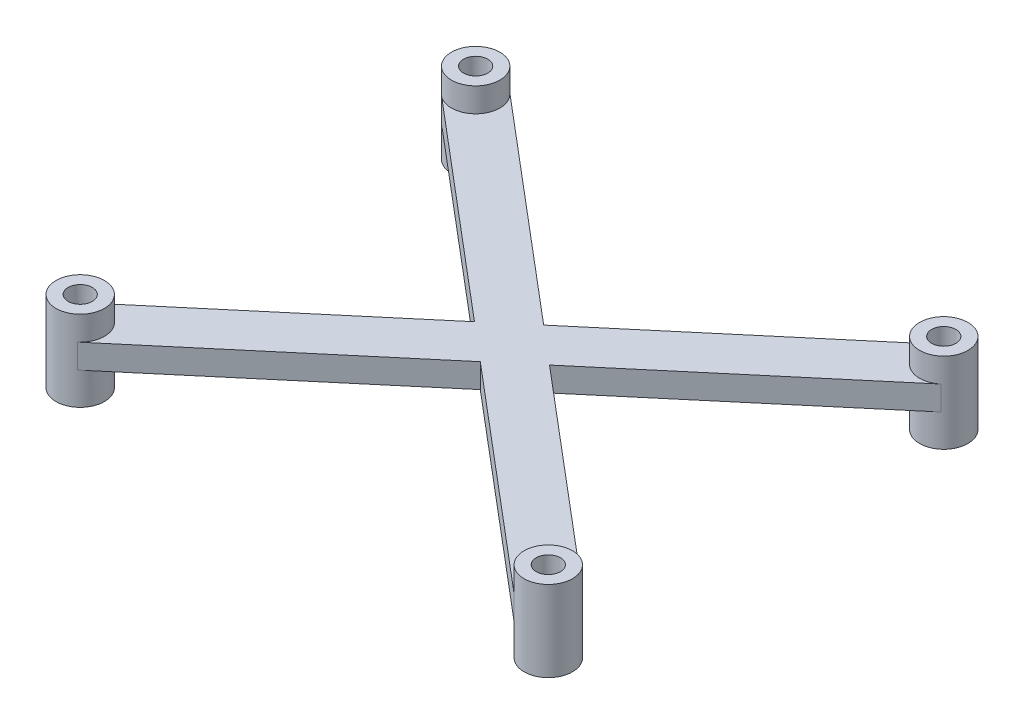
from build123d import *

# Parameters (mm, degrees)
CROQUIS1_R                = 3
SALIENTE_EXTRUIR1_DEPTH   = 4
SALIENTE_EXTRUIR1_2_DEPTH = 4
SALIENTE_EXTRUIR1_3_DEPTH = 4
SALIENTE_EXTRUIR1_4_DEPTH = 4
SALIENTE_EXTRUIR2_START   = 3
SALIENTE_EXTRUIR2_DEPTH   = 3
SALIENTE_EXTRUIR3_START   = 3
CROQUIS3_R                = 3
SALIENTE_EXTRUIR3_DEPTH   = 3
CROQUIS5_R                = 1.5
CORTAR_EXTRUIR1_DEPTH     = 13


with BuildPart() as part:
    # Croquis1 → Saliente-Extruir1 (new body)
    with BuildSketch(Plane(origin=(0, 0, 0), x_dir=(1, 0, 0), z_dir=(0, 1, 0))):
        with Locations(Location((-29, 24.5, 0), (0, 0, 270))):
            Circle(CROQUIS1_R)
    extrude(amount=-SALIENTE_EXTRUIR1_DEPTH)



with BuildPart() as body_2:
    # Croquis1 → Saliente-Extruir1 2 (new body)
    with BuildSketch(Plane(origin=(0, 0, 0), x_dir=(1, 0, 0), z_dir=(0, 1, 0))):
        with Locations(Location((-29, -24.5, 0), (0, 0, 270))):
            Circle(CROQUIS1_R)
    extrude(amount=-SALIENTE_EXTRUIR1_2_DEPTH)


with BuildPart() as body_3:
    # Croquis1 → Saliente-Extruir1 3 (new body)
    with BuildSketch(Plane(origin=(0, 0, 0), x_dir=(1, 0, 0), z_dir=(0, 1, 0))):
        with Locations(Location((29, -24.5, 0), (0, 0, 270))):
            Circle(CROQUIS1_R)
    extrude(amount=-SALIENTE_EXTRUIR1_3_DEPTH)


with BuildPart() as body_4:
    # Croquis1 → Saliente-Extruir1 4 (new body)
    with BuildSketch(Plane(origin=(0, 0, 0), x_dir=(1, 0, 0), z_dir=(0, 1, 0))):
        with Locations(Location((29, 24.5, 0), (0, 0, 270))):
            Circle(CROQUIS1_R)
    extrude(amount=-SALIENTE_EXTRUIR1_4_DEPTH)


with BuildPart() as part_1:
    add(part.part)

    add(body_2.part)  # Saliente-Extruir2 merges body 2

    add(body_3.part)  # Saliente-Extruir2 merges body 3

    add(body_4.part)  # Saliente-Extruir2 merges body 4
    # Croquis2 → Saliente-Extruir2 (add)
    with BuildSketch(Plane(origin=(0, 0, 0), x_dir=(1, 0, 0), z_dir=(0, 1, 0)).offset(SALIENTE_EXTRUIR2_START)):
        with BuildLine():
            Line((0, 3.927289505), (-27.063945052, 26.791656877))
            ThreePointArc((-27.063945052, 26.791656877), (-31.291656877, 26.436054948), (-30.936054948, 22.208343123))
            Line((-30.936054948, 22.208343123), (-4.648628393, 0))
            Line((-4.648628393, 0), (-30.936054948, -22.208343123))
            ThreePointArc((-30.936054948, -22.208343123), (-31.291656877, -26.436054948), (-27.063945052, -26.791656877))
            Line((-27.063945052, -26.791656877), (0, -3.927289505))
            Line((0, -3.927289505), (27.063945052, -26.791656877))
            ThreePointArc((27.063945052, -26.791656877), (31.291656877, -26.436054948), (30.936054948, -22.208343123))
            Line((30.936054948, -22.208343123), (4.648628393, 0))
            Line((4.648628393, 0), (30.936054948, 22.208343123))
            ThreePointArc((30.936054948, 22.208343123), (31.291656877, 26.436054948), (27.063945052, 26.791656877))
            Line((27.063945052, 26.791656877), (0, 3.927289505))
        make_face()
    extrude(amount=-SALIENTE_EXTRUIR2_DEPTH)

    # Croquis3 → Saliente-Extruir3 (add)
    with BuildSketch(Plane(origin=(0, 3, 0), x_dir=(1, 0, 0), z_dir=(0, 1, 0)).offset(SALIENTE_EXTRUIR3_START)):
        with Locations(Location((-29, 24.5, 0), (0, 0, 270))):
            Circle(CROQUIS3_R)
        with Locations(Location((-29, -24.5, 0), (0, 0, 270))):
            Circle(CROQUIS3_R)
        with Locations(Location((29, -24.5, 0), (0, 0, 270))):
            Circle(CROQUIS3_R)
        with Locations(Location((29, 24.5, 0), (0, 0, 270))):
            Circle(CROQUIS3_R)
    extrude(amount=-SALIENTE_EXTRUIR3_DEPTH)

    # Croquis5 → Cortar-Extruir1 (cut)
    with BuildSketch(Plane(origin=(0, 6, 0), x_dir=(1, 0, 0), z_dir=(0, 1, 0))):
        with Locations(Location((-29, 24.5, 0), (0, 0, 270))):
            Circle(CROQUIS5_R)
        with Locations(Location((29, 24.5, 0), (0, 0, 270))):
            Circle(CROQUIS5_R)
        with Locations(Location((29, -24.5, 0), (0, 0, 270))):
            Circle(CROQUIS5_R)
        with Locations(Location((-29, -24.5, 0), (0, 0, 270))):
            Circle(CROQUIS5_R)
    extrude(amount=-CORTAR_EXTRUIR1_DEPTH, mode=Mode.SUBTRACT)


solid = part_1.part
